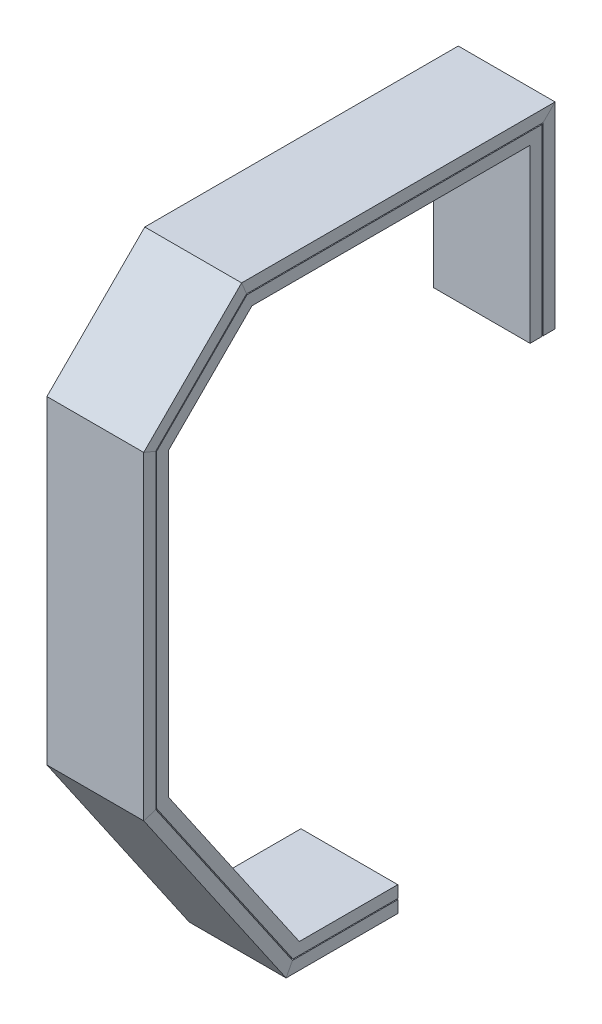
from build123d import *

# Parameters (mm, degrees)
CROQUIS1_W              = 50.8
CROQUIS1_H              = 6.31
SALIENTE_EXTRUIR1_DEPTH = 50.8


with BuildPart() as part:
    # Barrer1: sweep along a curve in space
    with BuildLine() as barrer1_path:
        Line((0, 0, 0), (0, 100, 0))
        Line((0, 100, 0), (0, 100, 160))
        Line((0, 100, 160), (0, 50.502525317, 209.497474683))
        Line((0, 50.502525317, 209.497474683), (0, -114.607474683, 209.497474683))
        Line((0, -221.177474683, 136.301058522), (0, -114.607474683, 209.497474683))
        Line((0, -221.177474683, 136.301058522), (0, -221.177474683, 79.371058522))
    # Croquis1 → Barrer1 (sweep)
    with BuildSketch(Plane(origin=(0, 0, 0), x_dir=(1, 0, 0), z_dir=(0, 1, 0))):
        Rectangle(CROQUIS1_W, CROQUIS1_H)
    sweep(path=barrer1_path.line, transition=Transition.RIGHT)


with BuildPart() as body_2:
    # Croquis2 → Saliente-Extruir1 (new body)
    with BuildSketch(Plane.ZY.offset(25.4)):
        Polygon((3.655, 0), (3.655, 96.345), (158.48604943, 96.345), (205.842474683, 48.988574746), (205.842474683, -113.473168771), (134.377369149, -217.522474683), (79.371058522, -217.522474683), (79.371058522, -211.212474683), (131.056307604, -211.212474683), (199.532474683, -111.514900561), (199.532474683, 46.374887168), (155.872361851, 90.035), (9.965, 90.035), (9.965, 0), align=None)
    extrude(amount=-SALIENTE_EXTRUIR1_DEPTH)


solid = Compound([part.part, body_2.part])
